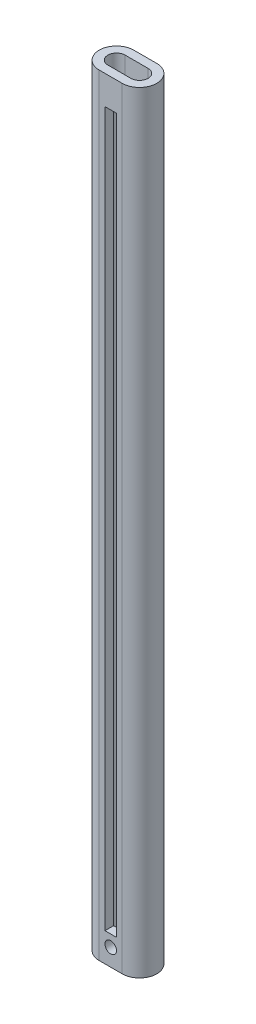
from build123d import *

# Parameters (mm, degrees)
SALIENTE_EXTRUIR1_DEPTH    = 124
SALIENTE_EXTRUIR3_START    = 5
CROQUIS7_W                 = 4
CROQUIS7_H                 = 1.5
CROQUIS7_W_2               = 2
CROQUIS7_W_3               = 1
SALIENTE_EXTRUIR3_DEPTH    = 5
CROQUIS8_W                 = 2
CROQUIS8_H                 = 1.5
CROQUIS8_W_2               = 4
SALIENTE_EXTRUIR4_DEPTH    = 5
CORTAR_EXTRUIR1_DEPTH      = 130.236217834
CORTAR_EXTRUIR1_DEPTH_BACK = 130.236217834
CROQUIS9_R                 = 1


with BuildPart() as part:
    # Croquis1 → Saliente-Extruir1 (new body)
    with BuildSketch(Plane(origin=(0, 0, 0), x_dir=(1, 0, 0), z_dir=(0, 1, 0))):
        with BuildLine():
            Line((-2, 1.5), (0, 1.5))
            Line((0, 1.5), (2, 1.5))
            ThreePointArc((2, 1.5), (3.5, 0), (2, -1.5))
            Line((2, -1.5), (1, -1.5))
            Line((1, -1.5), (1, -3))
            Line((1, -3), (2, -3))
            ThreePointArc((2, -3), (4.121320344, -2.121320344), (5, 0))
            ThreePointArc((5, 0), (4.121320344, 2.121320344), (2, 3))
            Line((2, 3), (0, 3))
            Line((0, 3), (-2, 3))
            ThreePointArc((-2, 3), (-4.121320347, 2.12132034), (-5, -9e-09))
            ThreePointArc((-5, -9e-09), (-4.12132034, -2.121320347), (-2, -3))
            Line((-2, -3), (-1, -3))
            Line((-1, -3), (-1, -1.5))
            Line((-1, -1.5), (-2, -1.5))
            ThreePointArc((-2, -1.5), (-3.5, 0), (-2, 1.5))
        make_face()
    extrude(amount=-SALIENTE_EXTRUIR1_DEPTH)

    # Croquis7 → Saliente-Extruir3 (add)
    with BuildSketch(Plane(origin=(0, 0, 0), x_dir=(1, 0, 0), z_dir=(0, 1, 0)).offset(SALIENTE_EXTRUIR3_START)):
        with Locations((0, 2.25)):
            Rectangle(CROQUIS7_W, CROQUIS7_H)
        with BuildLine():
            Line((-2, 1.5), (-2, 3))
            ThreePointArc((-2, 3), (-5, 0), (-2, -3))
            Line((-2, -3), (-2, -1.5))
            ThreePointArc((-2, -1.5), (-3.5, 0), (-2, 1.5))
        make_face()
        with Locations((0, -2.25)):
            Rectangle(CROQUIS7_W_2, CROQUIS7_H)
        with Locations((-1.5, -2.25)):
            Rectangle(CROQUIS7_W_3, CROQUIS7_H)
        with BuildLine():
            Line((2, 3), (2, 1.5))
            ThreePointArc((2, 1.5), (3.5, 0), (2, -1.5))
            Line((2, -1.5), (1, -1.5))
            Line((1, -1.5), (1, -3))
            Line((1, -3), (2, -3))
            ThreePointArc((2, -3), (5, 0), (2, 3))
        make_face()
    extrude(amount=-SALIENTE_EXTRUIR3_DEPTH)

    # Croquis8 → Saliente-Extruir4 (add)
    with BuildSketch(Plane.XZ.offset(124)):
        with BuildLine():
            Line((-2, -3), (-2, -1.5))
            ThreePointArc((-2, -1.5), (-3.5, 0), (-2, 1.5))
            Line((-2, 1.5), (-1, 1.5))
            Line((-1, 1.5), (-1, 3))
            Line((-1, 3), (-2, 3))
            ThreePointArc((-2, 3), (-5, 0), (-2, -3))
        make_face()
        with Locations((0, 2.25)):
            Rectangle(CROQUIS8_W, CROQUIS8_H)
        with BuildLine():
            Line((2, -1.5), (2, -3))
            ThreePointArc((2, -3), (5, 0), (2, 3))
            Line((2, 3), (1, 3))
            Line((1, 3), (1, 1.5))
            Line((1, 1.5), (2, 1.5))
            ThreePointArc((2, 1.5), (3.5, 0), (2, -1.5))
        make_face()
        with Locations((0, -2.25)):
            Rectangle(CROQUIS8_W_2, CROQUIS8_H)
    extrude(amount=SALIENTE_EXTRUIR4_DEPTH)

    # Croquis9 → Cortar-Extruir1 (cut, two sides: drawn at the far end of the back side and taken through both)
    with BuildSketch(Plane.XY.offset(3).offset(-CORTAR_EXTRUIR1_DEPTH_BACK)):
        with Locations((0, -126)):
            Circle(CROQUIS9_R)
    extrude(amount=CORTAR_EXTRUIR1_DEPTH + CORTAR_EXTRUIR1_DEPTH_BACK, mode=Mode.SUBTRACT)


solid = part.part
